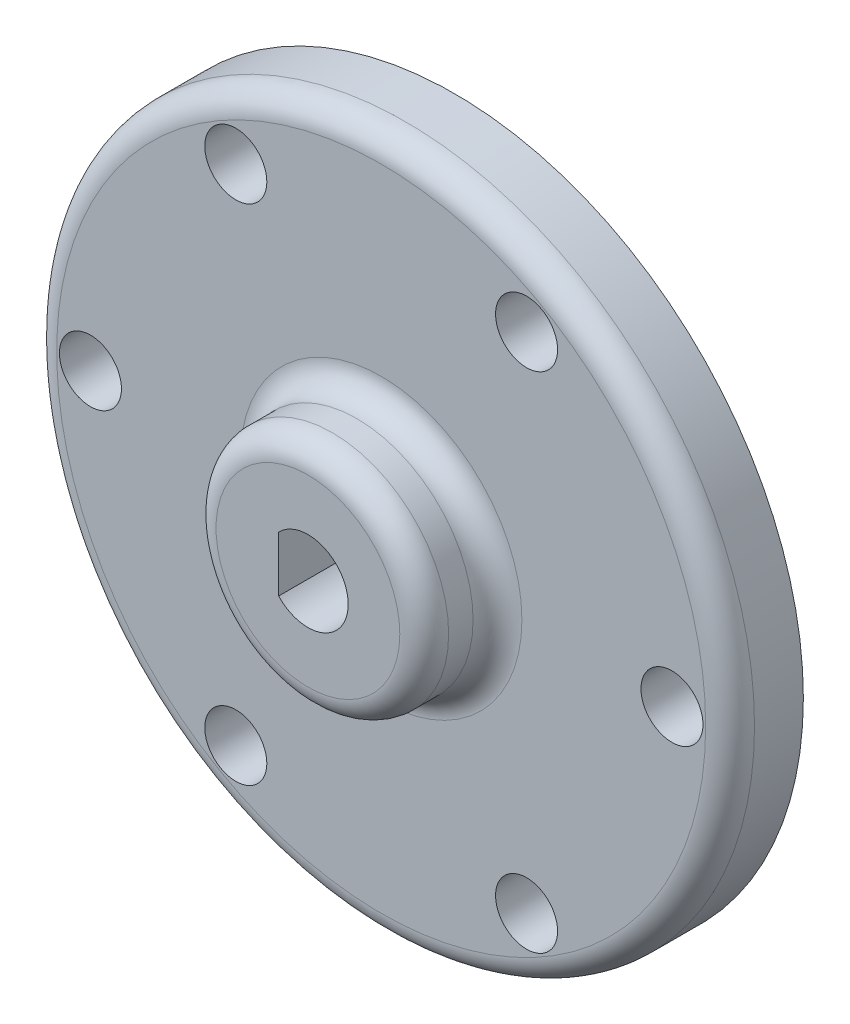
from build123d import *

# Parameters (mm, degrees)
SKETCH1_R           = 28.575
SKETCH1_R_2         = 2.54
BOSS_EXTRUDE1_DEPTH = 3
SKETCH2_R           = 9.525
BOSS_EXTRUDE2_DEPTH = 6
CUT_EXTRUDE1_REACH  = 44.155
FILLET1_R           = 2


with BuildPart() as part:
    # Sketch1 → Boss-Extrude1 (new, symmetric)
    with BuildSketch(Plane.XY):
        Circle(SKETCH1_R)
        with Locations((-23.8125, 0)):
            Circle(SKETCH1_R_2, mode=Mode.SUBTRACT)
        with Locations((-11.90625, 20.622229928)):
            Circle(SKETCH1_R_2, mode=Mode.SUBTRACT)
        with Locations((11.90625, 20.622229928)):
            Circle(SKETCH1_R_2, mode=Mode.SUBTRACT)
        with Locations((23.8125, 0)):
            Circle(SKETCH1_R_2, mode=Mode.SUBTRACT)
        with Locations((11.90625, -20.622229928)):
            Circle(SKETCH1_R_2, mode=Mode.SUBTRACT)
        with Locations((-11.90625, -20.622229928)):
            Circle(SKETCH1_R_2, mode=Mode.SUBTRACT)
    extrude(amount=BOSS_EXTRUDE1_DEPTH, both=True)

    # Sketch2 → Boss-Extrude2 (add)
    with BuildSketch(Plane.XY.offset(3)):
        Circle(SKETCH2_R)
    extrude(amount=BOSS_EXTRUDE2_DEPTH)

    # Sketch3 → Cut-Extrude1 (cut, up to next)
    with BuildSketch(Plane.XY.offset(9), mode=Mode.PRIVATE) as cut_extrude1_sk1:
        with BuildLine():
            ThreePointArc((3.3, 0), (1.218605761, 3.066757245), (-2.4, 2.264950331))
            Line((-2.4, 2.264950331), (-2.4, -2.264950331))
            ThreePointArc((-2.4, -2.264950331), (1.218605761, -3.066757245), (3.3, 0))
        make_face()
    cut_extrude1_tool1 = extrude(cut_extrude1_sk1.sketch, amount=-CUT_EXTRUDE1_REACH, mode=Mode.PRIVATE) & part.part
    add(cut_extrude1_tool1.solids().sort_by_distance((0.246613, 0, 9))[0], mode=Mode.SUBTRACT)

    # Fillet1
    fillet1_edges = [part.edges().sort_by_distance(p)[0] for p in [
        (-9.525, 0, 3),
        (-9.525, 0, 9),
        (-28.575, 0, 3),
    ]]
    fillet(fillet1_edges, radius=FILLET1_R)


solid = part.part
